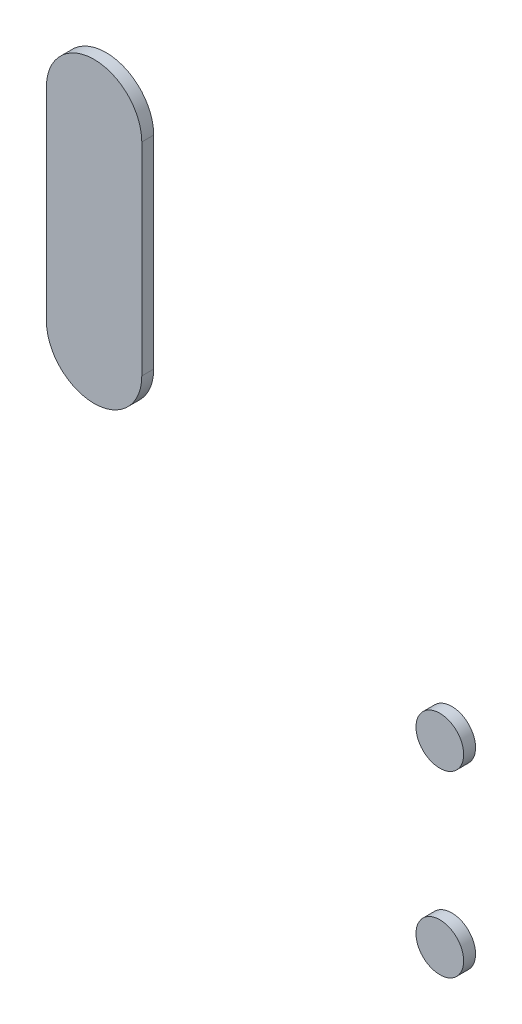
from build123d import *

# Parameters (mm, degrees)
SKETCH1_R             = 2
BOSS_EXTRUDE1_DEPTH   = 1
BOSS_EXTRUDE1_2_DEPTH = 1
BOSS_EXTRUDE1_3_DEPTH = 1


with BuildPart() as part:
    # Sketch1 → Boss-Extrude1 (new body)
    with BuildSketch(Plane.XY):
        with Locations((29, -24)):
            Circle(SKETCH1_R)
    extrude(amount=-BOSS_EXTRUDE1_DEPTH)


with BuildPart() as body_2:
    # Sketch1 → Boss-Extrude1 2 (new body)
    with BuildSketch(Plane.XY):
        with Locations((29, -9)):
            Circle(SKETCH1_R)
    extrude(amount=-BOSS_EXTRUDE1_2_DEPTH)


with BuildPart() as body_3:
    # Sketch1 → Boss-Extrude1 3 (new body)
    with BuildSketch(Plane.XY):
        with BuildLine():
            Line((4, 5), (4, 22))
            ThreePointArc((4, 22), (0, 26), (-4, 22))
            Line((-4, 22), (-4, 5))
            ThreePointArc((-4, 5), (0, 1), (4, 5))
        make_face()
    extrude(amount=-BOSS_EXTRUDE1_3_DEPTH)


solid = Compound([part.part, body_2.part, body_3.part])
